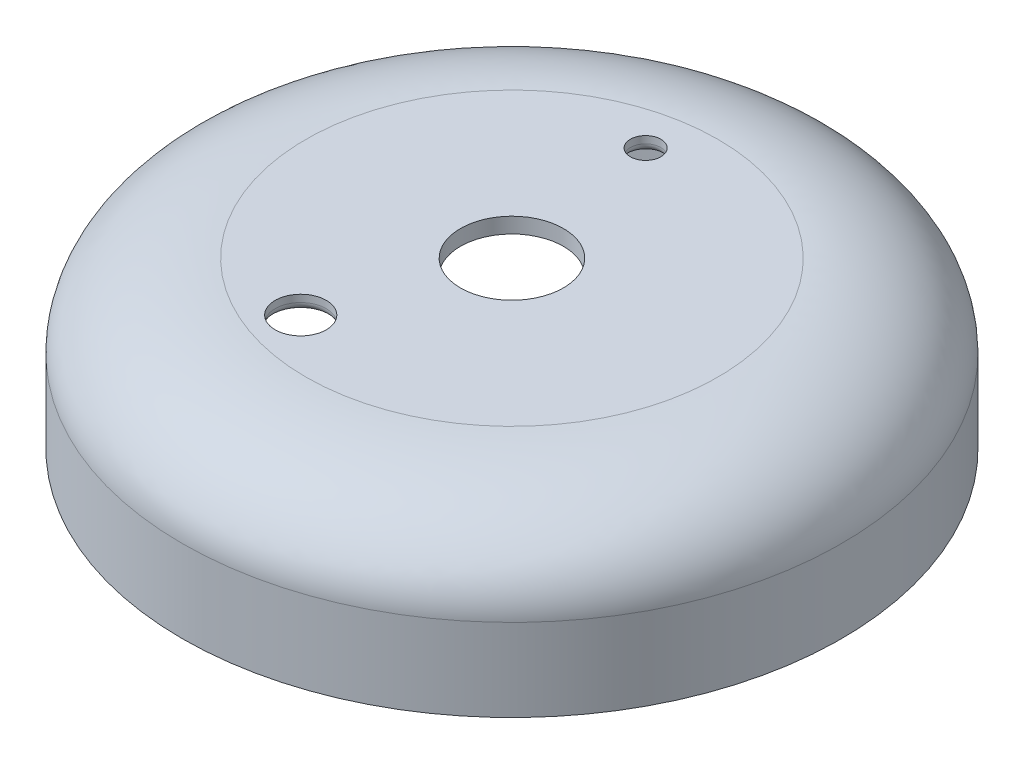
from build123d import *

# Parameters (mm, degrees)
SKETCH2_R          = 7.874
SKETCH2_R_2        = 15.875
SKETCH2_R_3        = 4.699
CUT_EXTRUDE1_DEPTH = 25.4
FILLET1_R          = 2.54


with BuildPart() as part:
    # Sketch1 → Revolve1 (revolve)
    with BuildSketch(Plane.XY, mode=Mode.PRIVATE) as revolve1_sk:
        with BuildLine():
            Line((0, 0), (0, -4.7625))
            Line((0, -4.7625), (63.5, -4.7625))
            add(Edge.make_bspline(
                [(96.8375, -25.4), (96.8375, -4.7625), (63.5, -4.7625)],
                knots=[0, 0, 0, 1.570796327, 1.570796327, 1.570796327], degree=2, weights=[1, 0.707106781, 1]))
            Line((96.8375, -25.4), (96.8375, -50.8))
            Line((96.8375, -50.8), (101.6, -50.8))
            Line((101.6, -50.8), (101.6, -25.4))
            add(Edge.make_bspline(
                [(101.6, -25.4), (101.6, 0), (63.5, 0)],
                knots=[3.141592654, 3.141592654, 3.141592654, 4.71238898, 4.71238898, 4.71238898], degree=2, weights=[1, 0.707106781, 1]))
            Line((63.5, 0), (0, 0))
        make_face()
    revolve(revolve1_sk.sketch.rotate(Axis((0, 29.511089747, 0), (0, -1, 0)), 90), axis=Axis((0, 29.511089747, 0), (0, -1, 0)))

    # Sketch2 → Cut-Extrude1 (cut)
    with BuildSketch(Plane(origin=(0, 0, 0), x_dir=(1, 0, 0), z_dir=(0, 1, 0))):
        with Locations(Location((-17.374623281, -47.736385136, 0), (0, 0, 270))):
            Circle(SKETCH2_R)
        with Locations(Location((0, 0, 0), (0, 0, 270))):
            Circle(SKETCH2_R_2)
        with Locations(Location((-8.821327425, 50.028233853, 0), (0, 0, 270))):
            Circle(SKETCH2_R_3)
    extrude(amount=-CUT_EXTRUDE1_DEPTH, mode=Mode.SUBTRACT)

    # Fillet1
    fillet1_edges = [part.edges().sort_by_distance(p)[0] for p in [
        (-17.374623281, -4.7625, 39.862385136),
        (-8.821327425, -4.7625, -54.727233853),
    ]]
    fillet(fillet1_edges, radius=FILLET1_R)


solid = part.part
